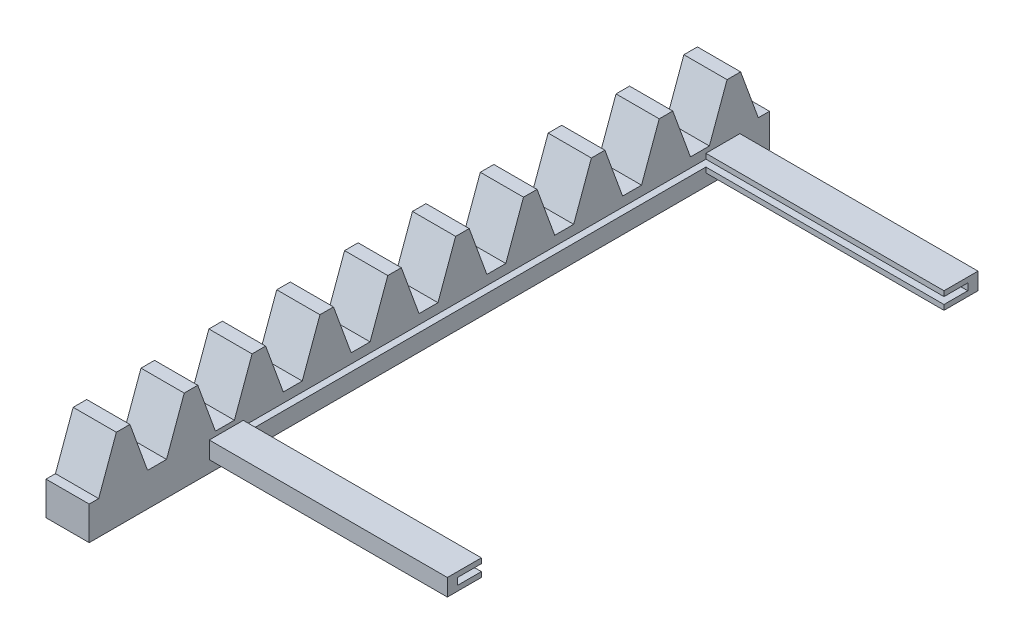
from build123d import *

# Parameters (mm, degrees)
BOSS_EXTRUDE1_DEPTH = 12.7
SKETCH3_W           = 5
SKETCH3_H           = 2
CUT_EXTRUDE1_DEPTH  = 75
BOSS_EXTRUDE3_DEPTH = 70


with BuildPart() as part:
    # Sketch1 → Boss-Extrude1 (new body)
    with BuildSketch(Plane(origin=(22.542150286, 0, 0), x_dir=(0, -1, 0), z_dir=(-1, 0, 0))):
        Polygon((-5.910199341, -78.211363822), (8.377300659, -83.411588544), (8.377300659, -86.704627867), (18.219800659, -86.704627867), (18.219800659, 113.295480133), (8.377300659, 113.295480133), (8.377300659, 110.511415536), (-5.910199341, 105.311190814), (-5.910199341, 101.330656125), (8.377300659, 96.130431403), (8.377300659, 90.562302208), (-5.910199341, 85.362077486), (-5.910199341, 81.381542798), (8.377300659, 76.181318076), (8.377300659, 70.613188881), (-5.910199341, 65.412964159), (-5.910199341, 61.43242947), (8.377300659, 56.232204748), (8.377300659, 50.664075553), (-5.910199341, 45.463850831), (-5.910199341, 41.483316143), (8.377300659, 36.283091421), (8.377300659, 30.714962226), (-5.910199341, 25.514737504), (-5.910199341, 21.534202815), (8.377300659, 16.333978093), (8.377300659, 10.765848898), (-5.910199341, 5.565624176), (-5.910199341, 1.585089488), (8.377300659, -3.615135234), (8.377300659, -9.183264429), (-5.910199341, -14.383489151), (-5.910199341, -18.36402384), (8.377300659, -23.564248562), (8.377300659, -29.132377757), (-5.910199341, -34.332602479), (-5.910199341, -38.313137167), (8.377300659, -43.513361889), (8.377300659, -49.081491084), (-5.910199341, -54.281715806), (-5.910199341, -58.262250495), (8.377300659, -63.462475217), (8.377300659, -69.030604412), (-5.910199341, -74.230829134), align=None)
    extrude(amount=-BOSS_EXTRUDE1_DEPTH)

    # Sketch3 → Cut-Extrude1 (cut, symmetric)
    with BuildSketch(Plane.XY):
        with Locations((32.742150286, -12.219800659)):
            Rectangle(SKETCH3_W, SKETCH3_H)
    extrude(amount=CUT_EXTRUDE1_DEPTH, both=True, mode=Mode.SUBTRACT)

    # Sketch4 → Boss-Extrude3 (add)
    with BuildSketch(Plane(origin=(35.242150286, 0, 0), x_dir=(0, 0, -1), z_dir=(1, 0, 0))):
        Polygon((-78, -9.719800659), (-78, -14.719800659), (-68, -14.719800659), (-68, -13.219800659), (-75, -13.219800659), (-75, -11.219800659), (-68, -11.219800659), (-68, -9.719800659), align=None)
        Polygon((68, -14.719800659), (78, -14.719800659), (78, -9.719800659), (68, -9.719800659), (68, -11.219800659), (75, -11.219800659), (75, -13.219800659), (68, -13.219800659), align=None)
    extrude(amount=BOSS_EXTRUDE3_DEPTH)


solid = part.part
